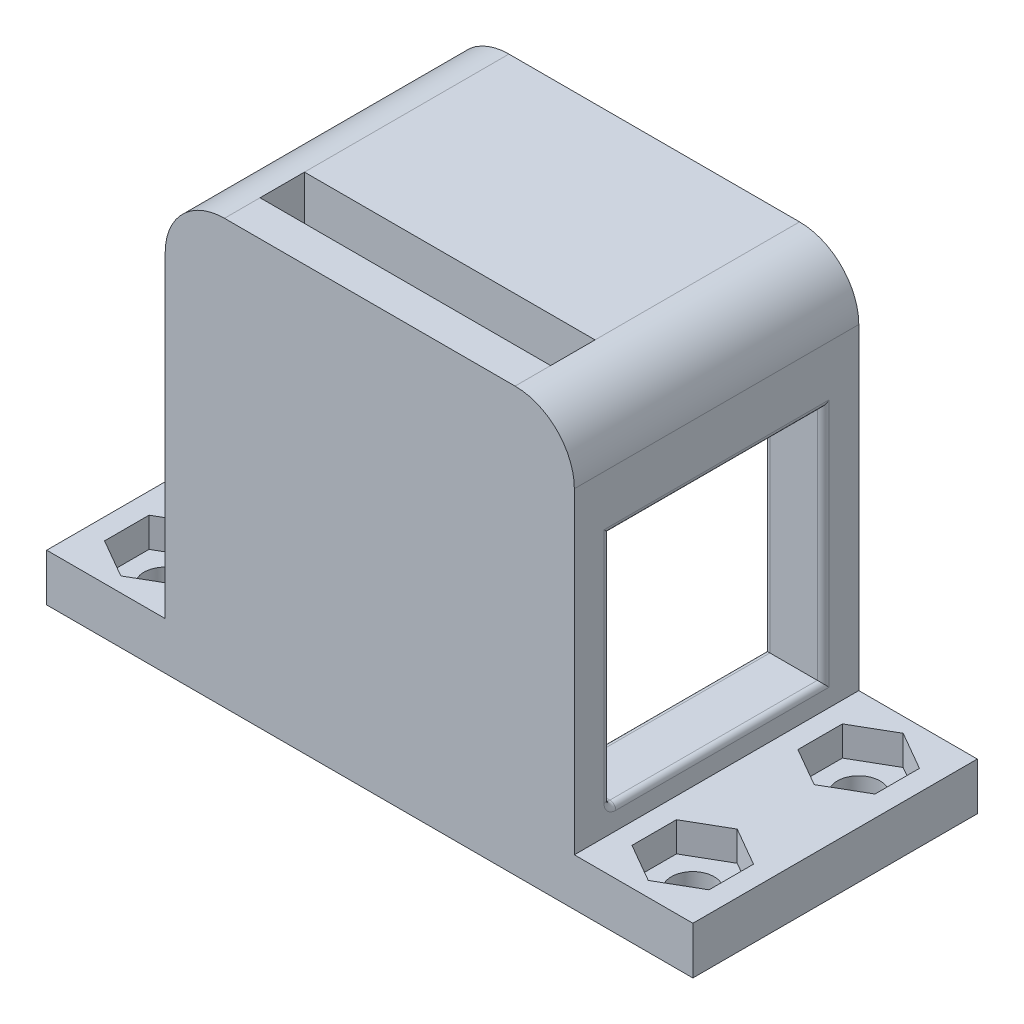
from build123d import *

# Parameters (mm, degrees)
BOSS_EXTRUDE1_DEPTH  = 17.5
BOSS_EXTRUDE2_DEPTH  = 6.5
SKETCH4_W            = 24.52025143
SKETCH4_H            = 31.2
CUT_EXTRUDE1_DEPTH   = 3.5
FILLET1_R            = 5
SKETCH7_W            = 10
SKETCH7_H            = 4
BOSS_EXTRUDE3_DEPTH  = 6.5
FILLET2_R            = 1
SKETCH8_W            = 18
SKETCH8_H            = 20
CUT_EXTRUDE4_DEPTH   = 66.139506352
FILLET3_R            = 0.5
CUT_EXTRUDE7_DEPTH   = 2.5
M3_CLEARANCE_HOLE1_D = 3.6
SKETCH14_W           = 24.52025143
SKETCH14_H           = 3.75
CUT_EXTRUDE8_DEPTH   = 48.880627126


with BuildPart() as part:
    # Sketch1 → Boss-Extrude1 (new body)
    with BuildSketch(Plane.XY):
        Polygon((-27.260125715, 5.300000005), (-12.260125715, 5.300000005), (-12.260125715, 36.500000005), (12.260125715, 36.500000005), (12.260125715, 5.300000005), (27.260125715, 5.300000005), (27.260125715, 9.300000005), (17.260125715, 9.300000005), (17.260125715, 38.858678923), (17.260125715, 41.050000005), (15.150659775, 41.050000005), (12, 41.050000005), (-12, 41.050000005), (-17.260125715, 41.050000005), (-17.260125715, 39.558678923), (-17.260125715, 9.300000005), (-27.260125715, 9.300000005), align=None)
    extrude(amount=BOSS_EXTRUDE1_DEPTH)

    # Sketch2 → Boss-Extrude2 (add)
    with BuildSketch(Plane.XY.offset(17.5)):
        Polygon((-17.260125715, 9.300000005), (-17.260125715, 41.050000005), (17.260125715, 41.050000005), (17.260125715, 5.300000005), (-17.260125715, 5.300000005), align=None)
    extrude(amount=BOSS_EXTRUDE2_DEPTH)

    # Sketch4 → Cut-Extrude1 (cut)
    with BuildSketch(Plane(origin=(0, 0, 17.5), x_dir=(-1, 0, 0), z_dir=(0, 0, -1))):
        with Locations((0, 20.900000005)):
            Rectangle(SKETCH4_W, SKETCH4_H)
    extrude(amount=-CUT_EXTRUDE1_DEPTH, mode=Mode.SUBTRACT)

    # Fillet1
    fillet1_edges = [part.edges().sort_by_distance(p)[0] for p in [
        (-17.260125715, 41.050000005, 12),
        (17.260125715, 41.050000005, 12),
    ]]
    fillet(fillet1_edges, radius=FILLET1_R)

    # Sketch7 → Boss-Extrude3 (add, through all)
    with BuildSketch(Plane.XY.offset(17.5)):
        with Locations((-22.260125715, 7.300000005)):
            Rectangle(SKETCH7_W, SKETCH7_H)
        with Locations((22.260125715, 7.300000005)):
            Rectangle(SKETCH7_W, SKETCH7_H)
    extrude(amount=BOSS_EXTRUDE3_DEPTH)

    # Fillet2
    fillet2_edges = [part.edges().sort_by_distance(p)[0] for p in [
        (12.260125715, 20.900000005, 0),
        (-12.260125715, 20.900000005, 0),
    ]]
    fillet(fillet2_edges, radius=FILLET2_R)

    # Sketch8 → Cut-Extrude4 (cut, through all)
    with BuildSketch(Plane.ZY.offset(17.260125715)):
        with Locations((12, 21.300000005)):
            Rectangle(SKETCH8_W, SKETCH8_H)
    extrude(amount=-CUT_EXTRUDE4_DEPTH, mode=Mode.SUBTRACT)

    # Fillet3
    fillet3_edges = [part.edges().sort_by_distance(p)[0] for p in [
        (12.260125715, 8.300000005, 21),
        (12.260125715, 21.300000005, 3),
        (17.260125715, 21.300000005, 3),
        (-12.260125715, 21.300000005, 3),
        (17.260125715, 21.300000005, 21),
        (17.260125715, 31.300000005, 12),
        (17.260125715, 11.300000005, 12),
        (14.760125715, 11.300000005, 21),
        (12.260125715, 11.300000005, 12),
        (-12.260125715, 11.300000005, 12),
        (-14.760125715, 11.300000005, 21),
        (-17.260125715, 21.300000005, 3),
        (-17.260125715, 11.300000005, 12),
        (-17.260125715, 21.300000005, 21),
        (-17.260125715, 31.300000005, 12),
        (-12.260125715, 8.300000005, 21),
    ]]
    fillet(fillet3_edges, radius=FILLET3_R)

    # Sketch6 → Cut-Extrude7 (cut)
    with BuildSketch(Plane(origin=(0, 9.300000005, 0), x_dir=(1, 0, 0), z_dir=(0, 1, 0))):
        Polygon((22.25, -1.24722325), (25.5, -3.123611625), (25.5, -6.876388375), (22.25, -8.75277675), (19, -6.876388375), (19, -3.123611625), align=None)
        Polygon((22.25, -22.75277675), (25.5, -20.876388375), (25.5, -17.123611625), (22.25, -15.24722325), (19, -17.123611625), (19, -20.876388375), align=None)
        Polygon((-22.25, -8.75277675), (-19, -6.876388375), (-19, -3.123611625), (-22.25, -1.24722325), (-25.5, -3.123611625), (-25.5, -6.876388375), align=None)
        Polygon((-22.25, -15.24722325), (-19, -17.123611625), (-19, -20.876388375), (-22.25, -22.75277675), (-25.5, -20.876388375), (-25.5, -17.123611625), align=None)
    extrude(amount=-CUT_EXTRUDE7_DEPTH, mode=Mode.SUBTRACT)

    # M3 Clearance Hole1 (through all)
    with Locations(Plane(origin=(0, 9.300000005, 0), x_dir=(1, 0, 0), z_dir=(0, 1, 0))):
        with Locations((22.25, -19), (22.25, -5), (-22.25, -5), (-22.25, -19)):
            Hole(M3_CLEARANCE_HOLE1_D / 2)

    # Sketch14 → Cut-Extrude8 (cut, through all)
    with BuildSketch(Plane.XZ.offset(-36.500000005)):
        with Locations((0, 19.125)):
            Rectangle(SKETCH14_W, SKETCH14_H)
    extrude(amount=-CUT_EXTRUDE8_DEPTH, mode=Mode.SUBTRACT)


solid = part.part
